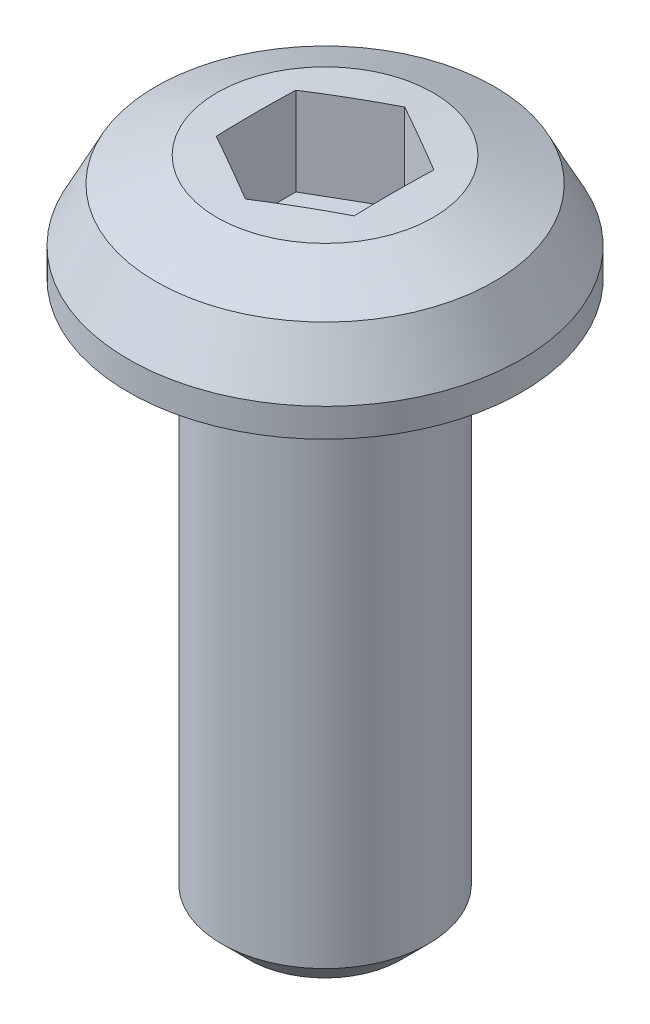
from build123d import *

# Parameters (mm, degrees)
CUT_EXTRUDE1_DEPTH = 1.35


with BuildPart() as part:
    # Sketch1 → Revolve1 (revolve)
    with BuildSketch(Plane.XY, mode=Mode.PRIVATE) as revolve1_sk:
        Polygon((0, -8), (1.1, -8), (1.5, -7.6), (1.5, 0), (2.85, 0), (2.85, 0.4125), (2.451, 1.188), (1.5675, 1.551), (0, 1.65), align=None)
    revolve(revolve1_sk.sketch.rotate(Axis((0, -10, 0), (0, 1, 0)), 90), axis=Axis((0, -10, 0), (0, 1, 0)))

    # Sketch2 → Cut-Extrude1 (cut)
    with BuildSketch(Plane(origin=(0, 1.65, 0), x_dir=(1, 0, 0), z_dir=(0, 1, 0))):
        Polygon((1, -0.577350269), (0, -1.154700538), (-1, -0.577350269), (-1, 0.577350269), (0, 1.154700538), (1, 0.577350269), align=None)
    extrude(amount=-CUT_EXTRUDE1_DEPTH, mode=Mode.SUBTRACT)


solid = part.part
